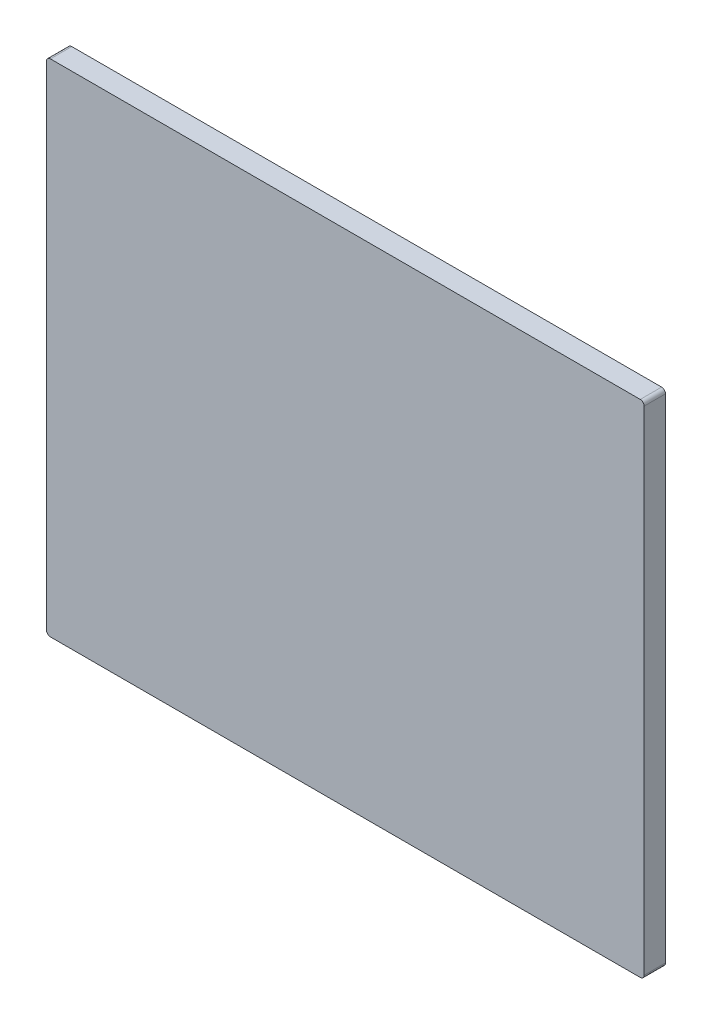
from build123d import *

# Parameters (mm, degrees)
SKETCH_1_W      = 308
SKETCH_1_H      = 258
EXTRUDE_1_DEPTH = 11
FILLET_1_R      = 2


with BuildPart() as part:
    # 草图1 → 凸台-拉伸1 (new body)
    with BuildSketch(Plane.XY):
        Rectangle(SKETCH_1_W, SKETCH_1_H)
    extrude(amount=EXTRUDE_1_DEPTH)

    # 圆角1
    fillet_1_edges = [part.edges().sort_by_distance(p)[0] for p in [
        (154, -129, 5.5),
        (-154, -129, 5.5),
        (-154, 129, 5.5),
        (154, 129, 5.5),
    ]]
    fillet(fillet_1_edges, radius=FILLET_1_R)


solid = part.part
